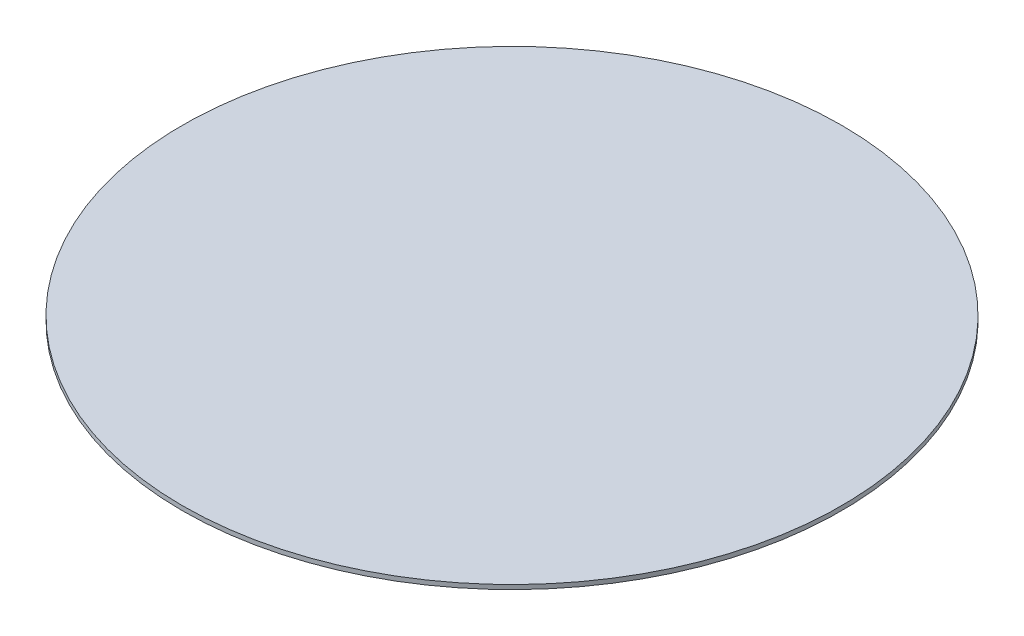
from build123d import *

# Parameters (mm, degrees)
SKETCH2_R           = 19.05
BOSS_EXTRUDE1_DEPTH = 0.127


with BuildPart() as part:
    # Sketch2 → Boss-Extrude1 (new, symmetric)
    with BuildSketch(Plane(origin=(0, 0, 0), x_dir=(1, 0, 0), z_dir=(0, 1, 0))):
        with Locations(Location((0, 0, 0), (0, 0, 270))):
            Circle(SKETCH2_R)
    extrude(amount=BOSS_EXTRUDE1_DEPTH, both=True)


solid = part.part
